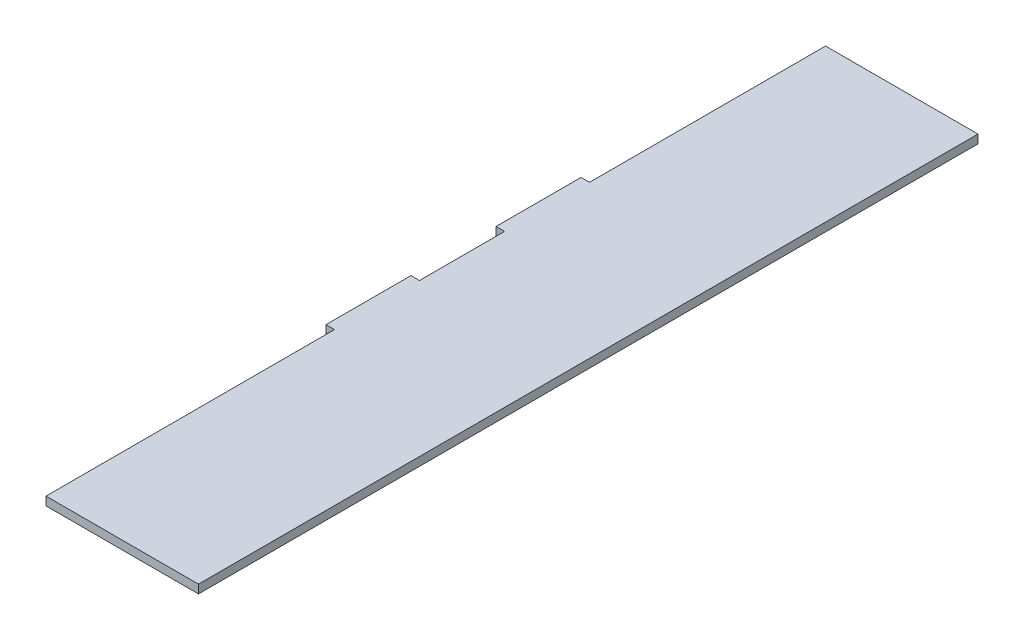
from build123d import *

# Parameters (mm, degrees)
SKETCH1_W           = 56.8
SKETCH1_H           = 275.1
BOSS_EXTRUDE1_DEPTH = 3
SKETCH2_W           = 3
SKETCH2_H           = 83.3
SKETCH2_H_2         = 101.8
SKETCH2_H_3         = 30
CUT_EXTRUDE1_DEPTH  = 5


with BuildPart() as part:
    # Sketch1 → Boss-Extrude1 (new body)
    with BuildSketch(Plane(origin=(0, 0, 0), x_dir=(1, 0, 0), z_dir=(0, 1, 0))):
        with Locations((28.4, 137.55)):
            Rectangle(SKETCH1_W, SKETCH1_H)
    extrude(amount=BOSS_EXTRUDE1_DEPTH)

    # Sketch2 → Cut-Extrude1 (cut)
    with BuildSketch(Plane(origin=(0, 3, 0), x_dir=(1, 0, 0), z_dir=(0, 1, 0))):
        with Locations((1.5, 233.45)):
            Rectangle(SKETCH2_W, SKETCH2_H)
        with Locations((1.5, 50.9)):
            Rectangle(SKETCH2_W, SKETCH2_H_2)
        with Locations((1.5, 146.8)):
            Rectangle(SKETCH2_W, SKETCH2_H_3)
    extrude(amount=-CUT_EXTRUDE1_DEPTH, mode=Mode.SUBTRACT)


solid = part.part
